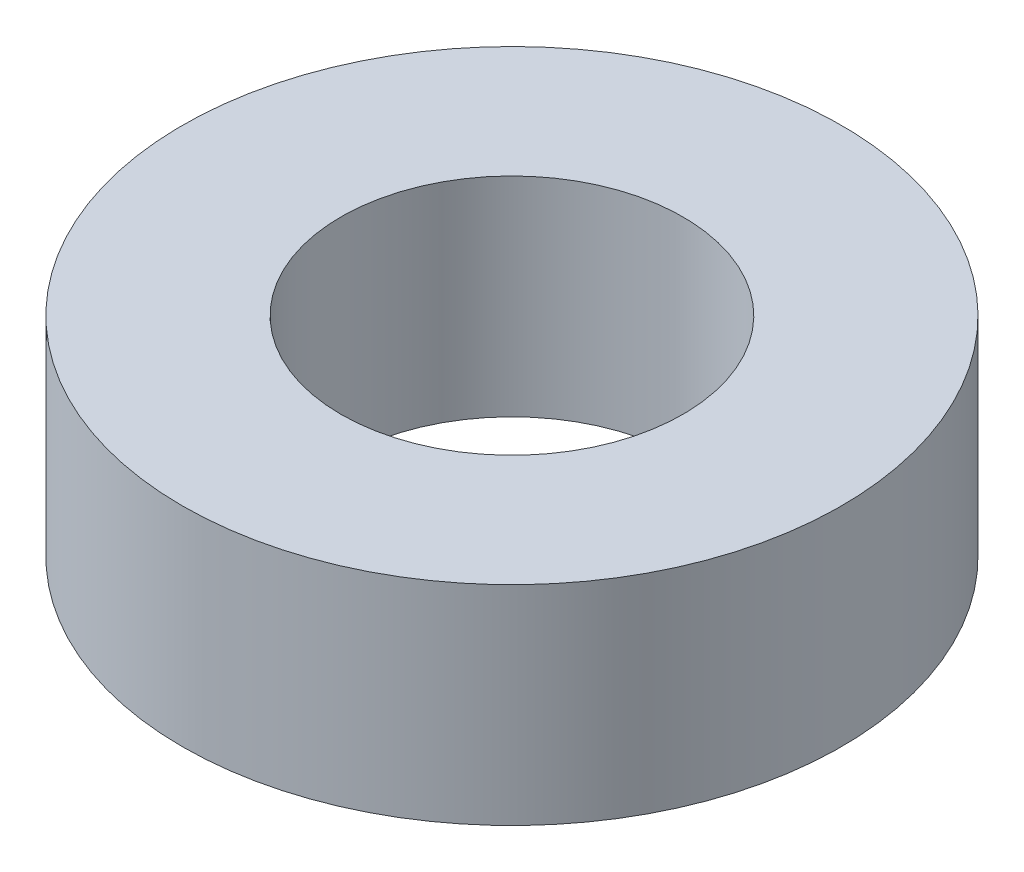
from build123d import *

# Parameters (mm, degrees)
SKETCH1_R           = 7.9
SKETCH1_R_2         = 4.1
BOSS_EXTRUDE1_DEPTH = 5


with BuildPart() as part:
    # Sketch1 → Boss-Extrude1 (new body)
    with BuildSketch(Plane(origin=(0, 0, 0), x_dir=(1, 0, 0), z_dir=(0, 1, 0))):
        with Locations(Location((0, 0, 0), (0, 0, 270))):
            Circle(SKETCH1_R)
        with Locations(Location((0, 0, 0), (0, 0, 270))):
            Circle(SKETCH1_R_2, mode=Mode.SUBTRACT)
    extrude(amount=BOSS_EXTRUDE1_DEPTH)


solid = part.part
